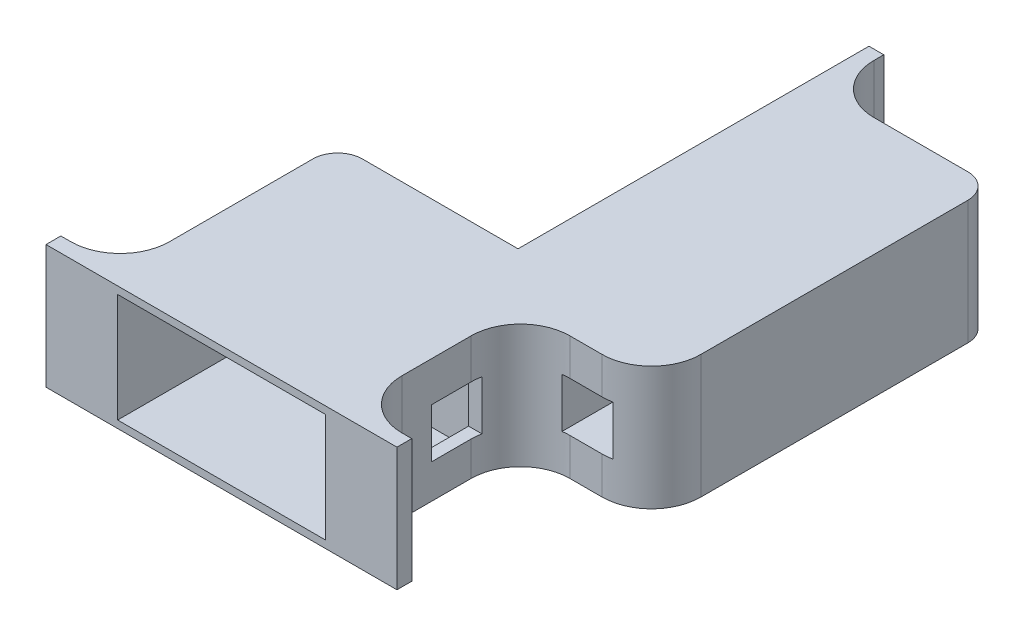
from build123d import *

# Parameters (mm, degrees)
BOSS_EXTRUDE1_DEPTH = 25
SKETCH2_W           = 42
SKETCH2_H           = 22
CUT_EXTRUDE1_DEPTH  = 30.5
SKETCH3_W           = 42
SKETCH3_H           = 22
CUT_EXTRUDE2_DEPTH  = 30.5
FILLET1_R           = 10
FILLET2_R           = 5
FILLET3_R           = 5
SKETCH5_W           = 10
SKETCH5_H           = 5
CUT_EXTRUDE3_DEPTH  = 30.5
SKETCH6_W           = 10
SKETCH6_H           = 10
CUT_EXTRUDE4_DEPTH  = 30.5


with BuildPart() as part:
    # Sketch1 → Boss-Extrude1 (new body)
    with BuildSketch(Plane(origin=(0, 0, 0), x_dir=(1, 0, 0), z_dir=(0, 1, 0))):
        Polygon((-23.5, -15.5), (-35.5, -15.5), (-35.5, -18.5), (0, -18.5), (35.5, -18.5), (35.5, -15.5), (23.5, -15.5), (23.5, 18.5), (50, 18.5), (50, 87.5), (16, 87.5), (16, 99.5), (13, 99.5), (13, 28.5), (-23.5, 28.5), align=None)
    extrude(amount=BOSS_EXTRUDE1_DEPTH)

    # Sketch2 → Cut-Extrude1 (cut)
    with BuildSketch(Plane.XY.offset(18.5)):
        with Locations((0, 12.5)):
            Rectangle(SKETCH2_W, SKETCH2_H)
    extrude(amount=-CUT_EXTRUDE1_DEPTH, mode=Mode.SUBTRACT)

    # Sketch3 → Cut-Extrude2 (cut)
    with BuildSketch(Plane.ZY.offset(-13)):
        with Locations((-64.067301197, 12.5)):
            Rectangle(SKETCH3_W, SKETCH3_H)
    extrude(amount=-CUT_EXTRUDE2_DEPTH, mode=Mode.SUBTRACT)

    # Fillet1
    fillet1_edges = [part.edges().sort_by_distance(p)[0] for p in [
        (16, 12.5, -87.5),
        (50, 12.5, -18.5),
        (23.5, 12.5, -18.5),
        (-23.5, 12.5, 15.5),
        (23.5, 12.5, 15.5),
    ]]
    fillet(fillet1_edges, radius=FILLET1_R)

    # Fillet2
    fillet2_edges = [part.edges().sort_by_distance(p)[0] for p in [
        (-23.5, 12.5, -28.5),
    ]]
    fillet(fillet2_edges, radius=FILLET2_R)

    # Fillet3
    fillet3_edges = [part.edges().sort_by_distance(p)[0] for p in [
        (50, 12.5, -87.5),
    ]]
    fillet(fillet3_edges, radius=FILLET3_R)

    # Sketch5 → Cut-Extrude3 (cut)
    with BuildSketch(Plane.ZY.offset(-21)):
        with Locations((-5.5, 9.426274429)):
            Rectangle(SKETCH5_W, SKETCH5_H)
        with Locations((-5.5, 14.426274429)):
            Rectangle(SKETCH5_W, SKETCH5_H)
    extrude(amount=-CUT_EXTRUDE3_DEPTH, mode=Mode.SUBTRACT)

    # Sketch6 → Cut-Extrude4 (cut)
    with BuildSketch(Plane(origin=(0, 0, -43.067301197), x_dir=(-1, 0, 0), z_dir=(0, 0, -1))):
        with Locations((-37, 12.54801)):
            Rectangle(SKETCH6_W, SKETCH6_H)
    extrude(amount=-CUT_EXTRUDE4_DEPTH, mode=Mode.SUBTRACT)


solid = part.part
